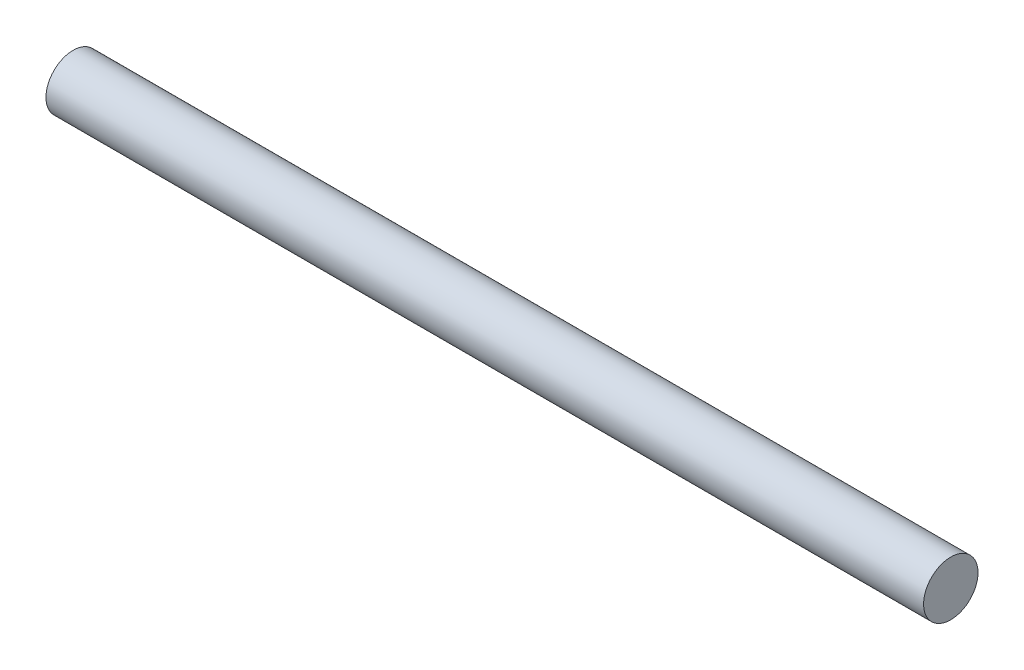
from build123d import *

# Parameters (mm, degrees)
SKETCH_1_R      = 4
EXTRUDE_1_DEPTH = 129


with BuildPart() as part:
    # 草图1 → 凸台-拉伸1 (new body)
    with BuildSketch(Plane(origin=(0, 0, 0), x_dir=(0, 0, -1), z_dir=(1, 0, 0))):
        Circle(SKETCH_1_R)
    extrude(amount=EXTRUDE_1_DEPTH)


solid = part.part
